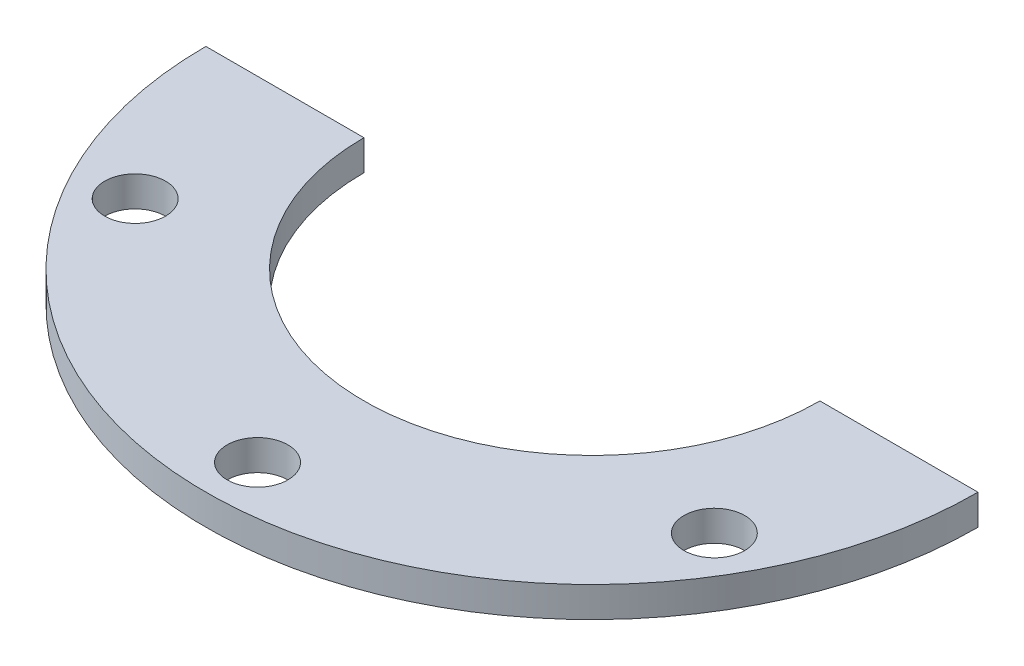
from build123d import *

# Parameters (mm, degrees)
SKETCH1_R               = 12.7
BOSS_EXTRUDE1_DEPTH     = 1
CUT_EXTRUDE1_DEPTH      = 18.98832955
CUT_EXTRUDE1_DEPTH_BACK = 18.98832955
SKETCH19_R              = 1
CUT_EXTRUDE2_DEPTH      = 18.98832955
CUT_EXTRUDE2_DEPTH_BACK = 18.98832955
SKETCH20_R              = 7.5
SKETCH21_W              = 65.874202484
SKETCH21_H              = 51.979273979
CUT_EXTRUDE3_DEPTH      = 18.98832955


with BuildPart() as part:
    # Sketch1 → Boss-Extrude1 (new body)
    with BuildSketch(Plane(origin=(0, 0, 0), x_dir=(1, 0, 0), z_dir=(0, 1, 0))):
        with Locations(Location((0, 0, 0), (0, 0, 270))):
            Circle(SKETCH1_R)
    extrude(amount=BOSS_EXTRUDE1_DEPTH)

    # Sketch19 → Cut-Extrude1 (cut, two sides: drawn at the far end of the back side and taken through both)
    with BuildSketch(Plane(origin=(0, 1, 0), x_dir=(1, 0, 0), z_dir=(0, 1, 0)).offset(-CUT_EXTRUDE1_DEPTH_BACK)):
        with Locations(Location((0, 11, 0), (0, 0, 270))):
            Circle(SKETCH19_R)
        with Locations(Location((9.526279442, 5.5, 0), (0, 0, 270))):
            Circle(SKETCH19_R)
        with Locations(Location((9.526279442, -5.5, 0), (0, 0, 270))):
            Circle(SKETCH19_R)
        with Locations(Location((0, -11, 0), (0, 0, 270))):
            Circle(SKETCH19_R)
        with Locations(Location((-9.526279442, -5.5, 0), (0, 0, 270))):
            Circle(SKETCH19_R)
        with Locations(Location((-9.526279442, 5.5, 0), (0, 0, 270))):
            Circle(SKETCH19_R)
    extrude(amount=CUT_EXTRUDE1_DEPTH + CUT_EXTRUDE1_DEPTH_BACK, mode=Mode.SUBTRACT)

    # Sketch20 → Cut-Extrude2 (cut, two sides: drawn at the far end of the back side and taken through both)
    with BuildSketch(Plane(origin=(0, 1, 0), x_dir=(1, 0, 0), z_dir=(0, 1, 0)).offset(-CUT_EXTRUDE2_DEPTH_BACK)):
        with Locations(Location((0, 0, 0), (0, 0, 270))):
            Circle(SKETCH20_R)
    extrude(amount=CUT_EXTRUDE2_DEPTH + CUT_EXTRUDE2_DEPTH_BACK, mode=Mode.SUBTRACT)

    # Sketch21 → Cut-Extrude3 (cut, through all)
    with BuildSketch(Plane.XY):
        with Locations((-3.816154381, 6.321647006)):
            Rectangle(SKETCH21_W, SKETCH21_H)
    extrude(amount=-CUT_EXTRUDE3_DEPTH, mode=Mode.SUBTRACT)


solid = part.part
